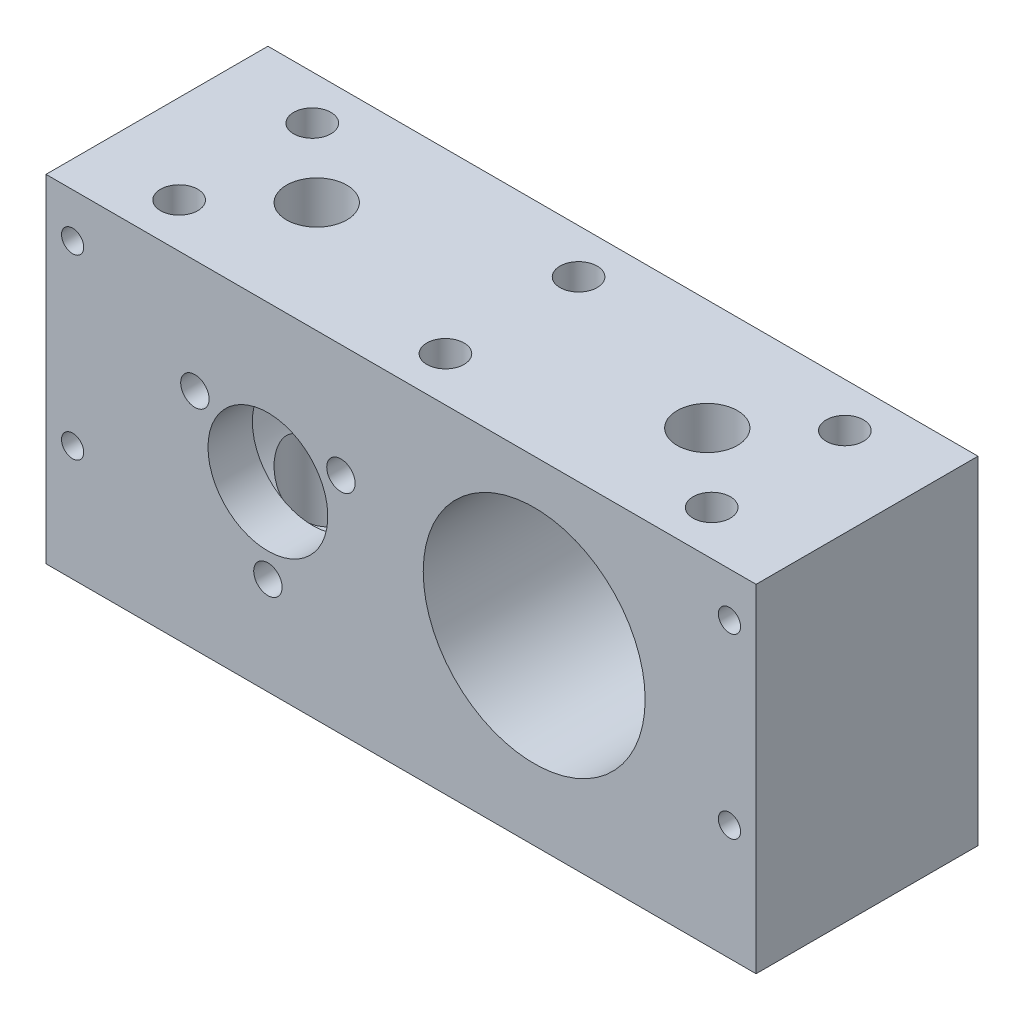
from build123d import *

# Parameters (mm, degrees)
SKETCH_1_W               = 70
SKETCH_1_H               = 35
EXTRUDE_1_DEPTH          = 25
SKETCH_3_R               = 12.5
CUT_EXTRUDE_2_DEPTH      = 20
SKETCH_5_R               = 6.75
CUT_EXTRUDE_4_DEPTH      = 5
SKETCH_6_R               = 1.6
CUT_EXTRUDE_5_DEPTH      = 5
SKETCH_8_R               = 12.5
CUT_EXTRUDE_6_DEPTH      = 20
SKETCH_9_R               = 6.75
CUT_EXTRUDE_7_DEPTH      = 20
SKETCH_10_R              = 1.6
CUT_EXTRUDE_8_DEPTH      = 44.945989578
SKETCH_11_R              = 3.4
CUT_EXTRUDE_9_DEPTH      = 56.452682532
EXTRUDE_START            = 3
SKETCH_13_W              = 70
SKETCH_13_H              = 25
SKETCH_13_R              = 3.4
EXTRUDE_3_DEPTH          = 3
SKETCH_2_R               = 2.1
CUT_EXTRUDE_1_DEPTH      = 58.393379519
SKETCH_15_W              = 25
SKETCH_15_H              = 38
EXTRUDE_4_DEPTH          = 5
SKETCH_16_W              = 25
SKETCH_16_H              = 38
EXTRUDE_5_DEPTH          = 5
SKETCH_17_R              = 2.1
CUT_EXTRUDE_11_DEPTH     = 61.572270988
SKETCH_18_R              = 1.25
CUT_EXTRUDE_12_DEPTH     = 5
MIRROR_2_COPY_1_SKETCH_R = 1.25
MIRROR_2_COPY_1_DEPTH    = 5


with BuildPart() as part:
    # 草图1 → 凸台-拉伸1 (new body)
    with BuildSketch(Plane.XY):
        Rectangle(SKETCH_1_W, SKETCH_1_H)
    extrude(amount=EXTRUDE_1_DEPTH)

    # 草图3 → 切除-拉伸2 (cut)
    with BuildSketch(Plane(origin=(0, 0, 0), x_dir=(-1, 0, 0), z_dir=(0, 0, -1))):
        with Locations((15, 0)):
            Circle(SKETCH_3_R)
    extrude(amount=-CUT_EXTRUDE_2_DEPTH, mode=Mode.SUBTRACT)

    # 草图5 → 切除-拉伸4 (cut)
    with BuildSketch(Plane(origin=(0, 0, 20), x_dir=(-1, 0, 0), z_dir=(0, 0, -1))):
        with Locations((15, 0)):
            Circle(SKETCH_5_R)
    extrude(amount=-CUT_EXTRUDE_4_DEPTH, mode=Mode.SUBTRACT)

    # 草图6 → 切除-拉伸5 (cut)
    with BuildSketch(Plane(origin=(0, 0, 20), x_dir=(-1, 0, 0), z_dir=(0, 0, -1))):
        with Locations((15, -9.5)):
            Circle(SKETCH_6_R)
        with Locations((6.772758664, 4.75)):
            Circle(SKETCH_6_R)
        with Locations((23.227241336, 4.75)):
            Circle(SKETCH_6_R)
    extrude(amount=-CUT_EXTRUDE_5_DEPTH, mode=Mode.SUBTRACT)

    # 草图8 → 切除-拉伸6 (cut)
    with BuildSketch(Plane.XY.offset(25)):
        with Locations((15, 0)):
            Circle(SKETCH_8_R)
    extrude(amount=-CUT_EXTRUDE_6_DEPTH, mode=Mode.SUBTRACT)

    # 草图9 → 切除-拉伸7 (cut)
    with BuildSketch(Plane.XY.offset(5)):
        with Locations((15, 0)):
            Circle(SKETCH_9_R)
    extrude(amount=-CUT_EXTRUDE_7_DEPTH, mode=Mode.SUBTRACT)

    # 草图10 → 切除-拉伸8 (cut, through all)
    with BuildSketch(Plane.XY.offset(5)):
        with Locations((15, -9.5)):
            Circle(SKETCH_10_R)
        with Locations((6.772758664, 4.75)):
            Circle(SKETCH_10_R)
        with Locations((23.227241336, 4.75)):
            Circle(SKETCH_10_R)
    extrude(amount=-CUT_EXTRUDE_8_DEPTH, mode=Mode.SUBTRACT)

    # 草图11 → 切除-拉伸9 (cut, through all)
    with BuildSketch(Plane.XZ.offset(17.5)):
        with Locations(Location((22, 12.5, 0), (0, 0, 270))):
            Circle(SKETCH_11_R)
        with Locations(Location((-22, 12.5, 0), (0, 0, 270))):
            Circle(SKETCH_11_R)
    extrude(amount=-CUT_EXTRUDE_9_DEPTH, mode=Mode.SUBTRACT)

    # 草图13 → 凸台-拉伸3 (add)
    with BuildSketch(Plane.XZ.offset(17.5).offset(EXTRUDE_START)):
        with Locations((0, 12.5)):
            Rectangle(SKETCH_13_W, SKETCH_13_H)
        with Locations(Location((-22, 12.5, 0), (0, 0, 270))):
            Circle(SKETCH_13_R, mode=Mode.SUBTRACT)
        with Locations(Location((22, 12.5, 0), (0, 0, 270))):
            Circle(SKETCH_13_R, mode=Mode.SUBTRACT)
    extrude(amount=-EXTRUDE_3_DEPTH)

    # 草图2 → 切除-拉伸1 (cut, through all)
    with BuildSketch(Plane(origin=(0, 17.5, 0), x_dir=(1, 0, 0), z_dir=(0, 1, 0))):
        with Locations(Location((30, -5, 0), (0, 0, 270))):
            Circle(SKETCH_2_R)
        with Locations(Location((30, -20, 0), (0, 0, 270))):
            Circle(SKETCH_2_R)
        with Locations(Location((-30, -5, 0), (0, 0, 270))):
            Circle(SKETCH_2_R)
        with Locations(Location((-30, -20, 0), (0, 0, 270))):
            Circle(SKETCH_2_R)
    extrude(amount=-CUT_EXTRUDE_1_DEPTH, mode=Mode.SUBTRACT)

    # 草图15 → 凸台-拉伸4 (add)
    with BuildSketch(Plane.ZY.offset(35)):
        with Locations((12.5, -1.5)):
            Rectangle(SKETCH_15_W, SKETCH_15_H)
    extrude(amount=EXTRUDE_4_DEPTH)

    # 草图16 → 凸台-拉伸5 (add)
    with BuildSketch(Plane(origin=(35, 0, 0), x_dir=(0, 0, -1), z_dir=(1, 0, 0))):
        with Locations((-12.5, -1.5)):
            Rectangle(SKETCH_16_W, SKETCH_16_H)
    extrude(amount=EXTRUDE_5_DEPTH)

    # 草图17 → 切除-拉伸11 (cut, through all)
    with BuildSketch(Plane.XZ.offset(20.5)):
        with Locations(Location((0, 5, 0), (0, 0, 270))):
            Circle(SKETCH_17_R)
        with Locations(Location((0, 20, 0), (0, 0, 90))):
            Circle(SKETCH_17_R)
    extrude(amount=-CUT_EXTRUDE_11_DEPTH, mode=Mode.SUBTRACT)

    # 草图18 → 切除-拉伸12 (cut)
    with BuildSketch(Plane(origin=(0, 0, 0), x_dir=(-1, 0, 0), z_dir=(0, 0, -1))):
        with Locations((-37, 12.5)):
            Circle(SKETCH_18_R)
        with Locations((-37, -7.5)):
            Circle(SKETCH_18_R)
    cut_extrude_12 = extrude(amount=-CUT_EXTRUDE_12_DEPTH, mode=Mode.SUBTRACT)

    # 镜向1: 切除-拉伸12 across plane
    add(cut_extrude_12.mirror(Plane.XY.offset(12.5)), mode=Mode.SUBTRACT)

    # 镜向2: 切除-拉伸12 across plane
    add(cut_extrude_12.mirror(Plane(origin=(0, 0, 0), x_dir=(0, 0, 1), z_dir=(1, 0, 0))), mode=Mode.SUBTRACT)

    # 镜向2 copy 1 sketch → 镜向2 copy 1 (cut)
    with BuildSketch(Plane.XY.offset(25)):
        with Locations((-37, 12.5)):
            Circle(MIRROR_2_COPY_1_SKETCH_R)
        with Locations((-37, -7.5)):
            Circle(MIRROR_2_COPY_1_SKETCH_R)
    extrude(amount=-MIRROR_2_COPY_1_DEPTH, mode=Mode.SUBTRACT)


solid = part.part
